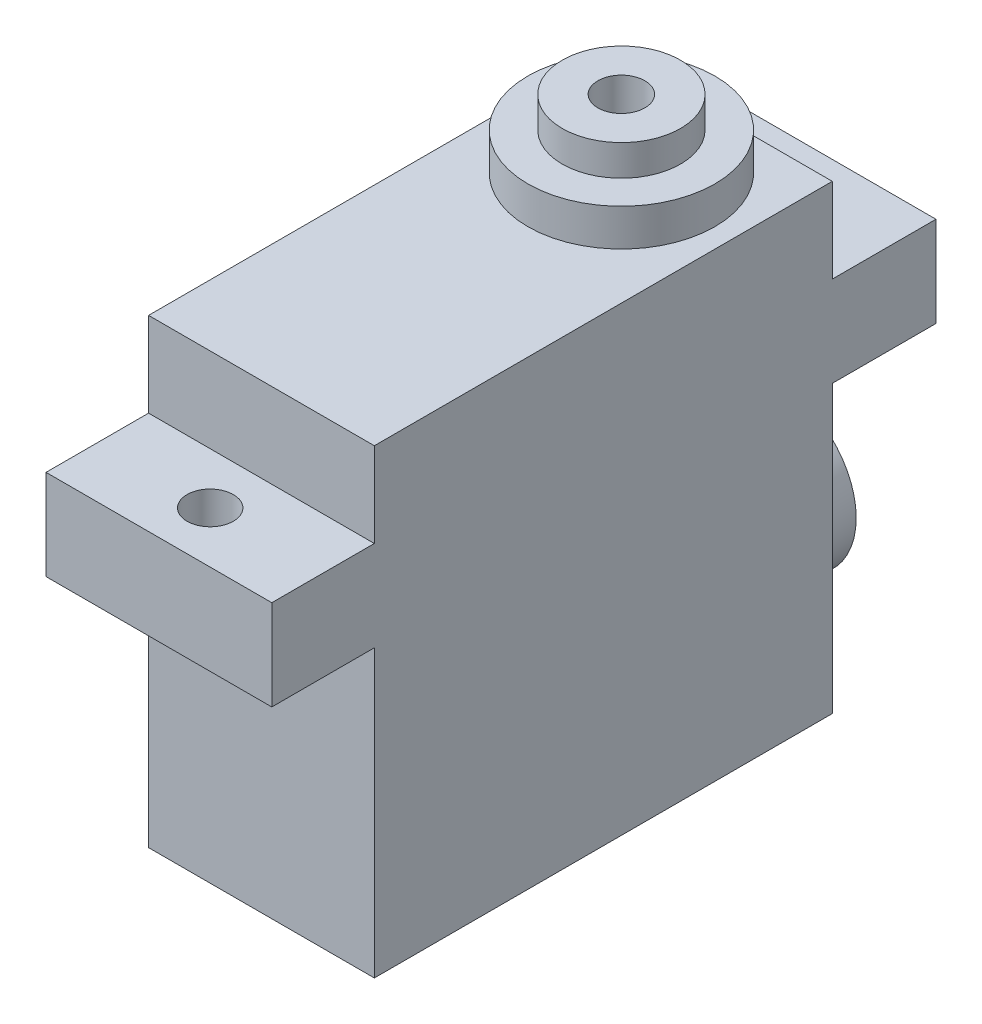
from build123d import *

# Parameters (mm, degrees)
SKETCH1_W                = 15.24
SKETCH1_H                = 30.9118
BOSS_EXTRUDE1_DEPTH      = 31.115
BOSS_EXTRUDE2_DEPTH      = 6.9215
BOSS_EXTRUDE2_DEPTH_BACK = 37.9095
SKETCH2_W                = 15.24
SKETCH2_H                = 6.096
SKETCH3_R                = 5.2705
BOSS_EXTRUDE3_DEPTH      = 3.9624
SKETCH4_R                = 6.3119
BOSS_EXTRUDE4_DEPTH      = 2.5019
CUT_EXTRUDE1_REACH       = 50.11
SKETCH8_R                = 1.5621
CUT_EXTRUDE2_REACH       = 50.11
SKETCH9_R                = 1.5621
SKETCH10_R               = 3.99415
BOSS_EXTRUDE5_DEPTH      = 2.0828
SKETCH13_R               = 1.5875
CUT_EXTRUDE3_DEPTH       = 2.54


with BuildPart() as part:
    # Sketch1 → Boss-Extrude1 (new body)
    with BuildSketch(Plane(origin=(0, 0, 0), x_dir=(1, 0, 0), z_dir=(0, 1, 0))):
        with Locations((7.62, 15.4559)):
            Rectangle(SKETCH1_W, SKETCH1_H)
    extrude(amount=BOSS_EXTRUDE1_DEPTH)

    # Sketch2 → Boss-Extrude2 (add, two sides: drawn at the far end of the back side and taken through both)
    with BuildSketch(Plane.XY.offset(-BOSS_EXTRUDE2_DEPTH_BACK)):
        with Locations((7.62, 22.352)):
            Rectangle(SKETCH2_W, SKETCH2_H)
    extrude(amount=BOSS_EXTRUDE2_DEPTH + BOSS_EXTRUDE2_DEPTH_BACK)

    # Sketch3 → Boss-Extrude3 (add)
    with BuildSketch(Plane(origin=(0, 0, -30.9118), x_dir=(-1, 0, 0), z_dir=(0, 0, -1))):
        with Locations(Location((-7.62, 8.2804, 0), (0, 0, 180))):
            Circle(SKETCH3_R)
    extrude(amount=BOSS_EXTRUDE3_DEPTH)

    # Sketch4 → Boss-Extrude4 (add)
    with BuildSketch(Plane(origin=(0, 31.115, 0), x_dir=(1, 0, 0), z_dir=(0, 1, 0))):
        with Locations(Location((7.62, 24.2951, 0), (0, 0, 90))):
            Circle(SKETCH4_R)
    extrude(amount=BOSS_EXTRUDE4_DEPTH)

    # Sketch8 → Cut-Extrude1 (cut, up to next)
    with BuildSketch(Plane(origin=(0, 25.4, 0), x_dir=(1, 0, 0), z_dir=(0, 1, 0)), mode=Mode.PRIVATE) as cut_extrude1_sk1:
        with Locations(Location((7.62, -3.46075, 0), (0, 0, 270))):
            Circle(SKETCH8_R)
    cut_extrude1_tool1 = extrude(cut_extrude1_sk1.sketch, amount=-CUT_EXTRUDE1_REACH, mode=Mode.PRIVATE) & part.part
    add(cut_extrude1_tool1.solids().sort_by_distance((7.62, 25.4, 3.46075))[0], mode=Mode.SUBTRACT)

    # Sketch9 → Cut-Extrude2 (cut, up to next)
    with BuildSketch(Plane(origin=(0, 25.4, 0), x_dir=(1, 0, 0), z_dir=(0, 1, 0)), mode=Mode.PRIVATE) as cut_extrude2_sk1:
        with Locations(Location((7.62, 34.41065, 0), (0, 0, 270))):
            Circle(SKETCH9_R)
    cut_extrude2_tool1 = extrude(cut_extrude2_sk1.sketch, amount=-CUT_EXTRUDE2_REACH, mode=Mode.PRIVATE) & part.part
    add(cut_extrude2_tool1.solids().sort_by_distance((7.62, 25.4, -34.41065))[0], mode=Mode.SUBTRACT)

    # Sketch10 → Boss-Extrude5 (add)
    with BuildSketch(Plane(origin=(0, 33.6169, 0), x_dir=(1, 0, 0), z_dir=(0, 1, 0))):
        with Locations(Location((7.62, 24.2951, 0), (0, 0, 270))):
            Circle(SKETCH10_R)
    extrude(amount=BOSS_EXTRUDE5_DEPTH)

    # Sketch13 → Cut-Extrude3 (cut)
    with BuildSketch(Plane(origin=(0, 35.6997, 0), x_dir=(1, 0, 0), z_dir=(0, 1, 0))):
        with Locations(Location((7.62, 24.2951, 0), (0, 0, 270))):
            Circle(SKETCH13_R)
    extrude(amount=-CUT_EXTRUDE3_DEPTH, mode=Mode.SUBTRACT)


solid = part.part
